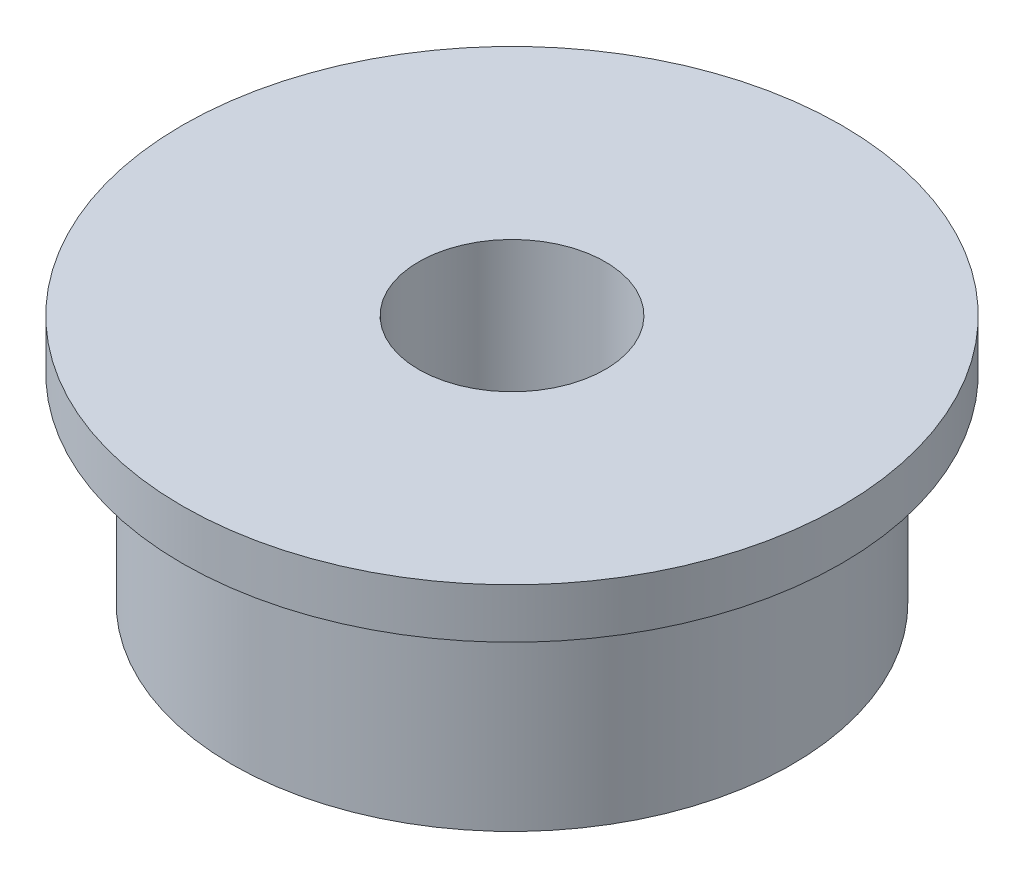
from build123d import *

# Parameters (mm, degrees)
SKETCH_1_R      = 4.5
SKETCH_1_R_2    = 1.5
EXTRUDE_1_DEPTH = 4
EXTRUDE_START   = -0.8
SKETCH_2_R      = 5.3
SKETCH_2_R_2    = 4.5
EXTRUDE_2_DEPTH = 0.8


with BuildPart() as part:
    # 草图1 → 凸台-拉伸1 (new body)
    with BuildSketch(Plane(origin=(0, 0, 0), x_dir=(1, 0, 0), z_dir=(0, 1, 0))):
        with Locations(Location((0, 0, 0), (0, 0, 270))):
            Circle(SKETCH_1_R)
        with Locations(Location((0, 0, 0), (0, 0, 270))):
            Circle(SKETCH_1_R_2, mode=Mode.SUBTRACT)
    extrude(amount=EXTRUDE_1_DEPTH)

    # 草图2 → 凸台-拉伸2 (add)
    with BuildSketch(Plane(origin=(0, 4, 0), x_dir=(1, 0, 0), z_dir=(0, 1, 0)).offset(EXTRUDE_START)):
        with Locations(Location((0, 0, 0), (0, 0, 270))):
            Circle(SKETCH_2_R)
        with Locations(Location((0, 0, 0), (0, 0, 270))):
            Circle(SKETCH_2_R_2, mode=Mode.SUBTRACT)
    extrude(amount=EXTRUDE_2_DEPTH)


solid = part.part
